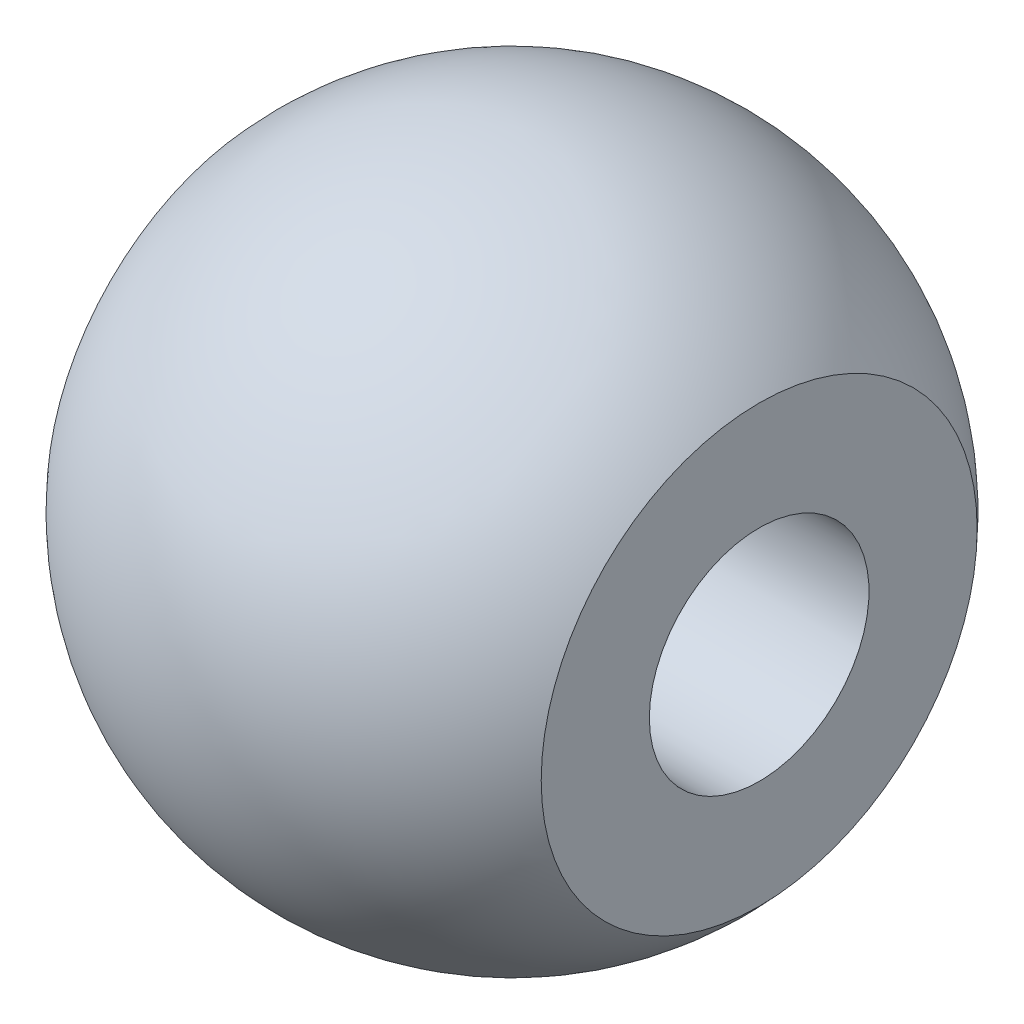
from build123d import *

# Parameters (mm, degrees)
SKETCH2_R          = 2
CUT_EXTRUDE1_DEPTH = 13.369316877
CHAMFER1_SIZE      = 1


with BuildPart() as part:
    # Sketch1 → Revolve1 (revolve)
    with BuildSketch(Plane(origin=(0, 0, 0), x_dir=(1, 0, 0), z_dir=(0, 1, 0))):
        with BuildLine():
            Line((-4.5, 3.968626967), (-4.5, 0))
            Line((-4.5, 0), (4.5, 0))
            Line((4.5, 0), (4.5, 3.968626967))
            ThreePointArc((4.5, 3.968626967), (0, 6), (-4.5, 3.968626967))
        make_face()
    revolve(axis=Axis((-4.5, 0, 0), (1, 0, 0)))

    # Sketch2 → Cut-Extrude1 (cut, through all)
    with BuildSketch(Plane.ZY.offset(4.5)):
        Circle(SKETCH2_R)
    extrude(amount=-CUT_EXTRUDE1_DEPTH, mode=Mode.SUBTRACT)

    # Chamfer1
    chamfer1_edges = [part.edges().sort_by_distance(p)[0] for p in [
        (-4.5, 0, -2),
    ]]
    chamfer(chamfer1_edges, length=CHAMFER1_SIZE)


solid = part.part
